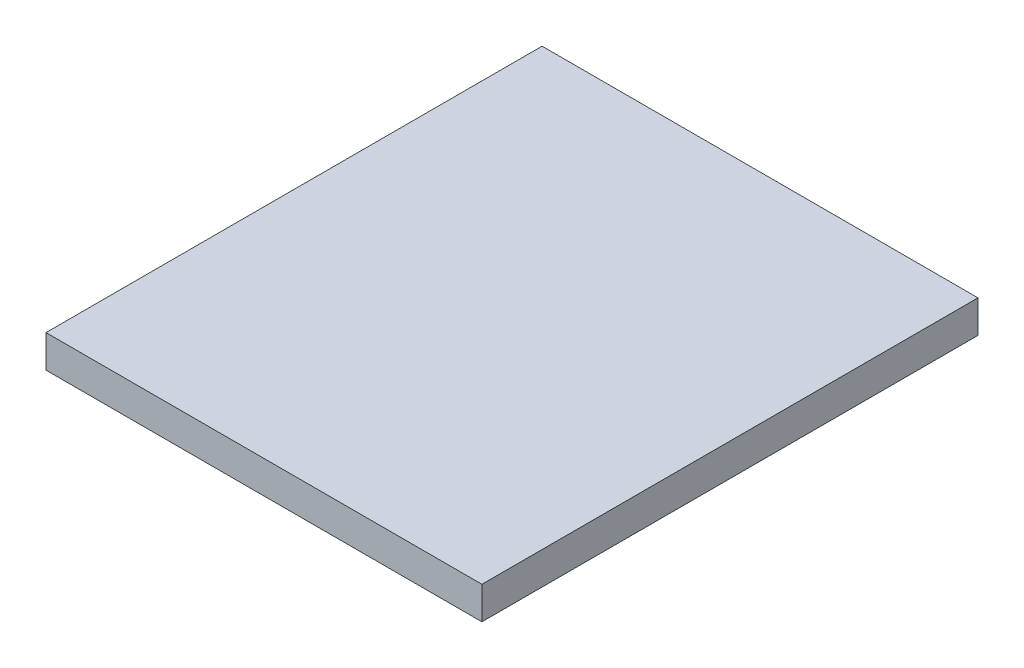
from build123d import *

# Parameters (mm, degrees)
SKETCH2_W           = 34.036
SKETCH2_H           = 38.735
BOSS_EXTRUDE1_DEPTH = 2.54


with BuildPart() as part:
    # Sketch2 → Boss-Extrude1 (new body)
    with BuildSketch(Plane(origin=(0, 0, 0), x_dir=(1, 0, 0), z_dir=(0, 1, 0))):
        Rectangle(SKETCH2_W, SKETCH2_H)
    extrude(amount=BOSS_EXTRUDE1_DEPTH)


solid = part.part
